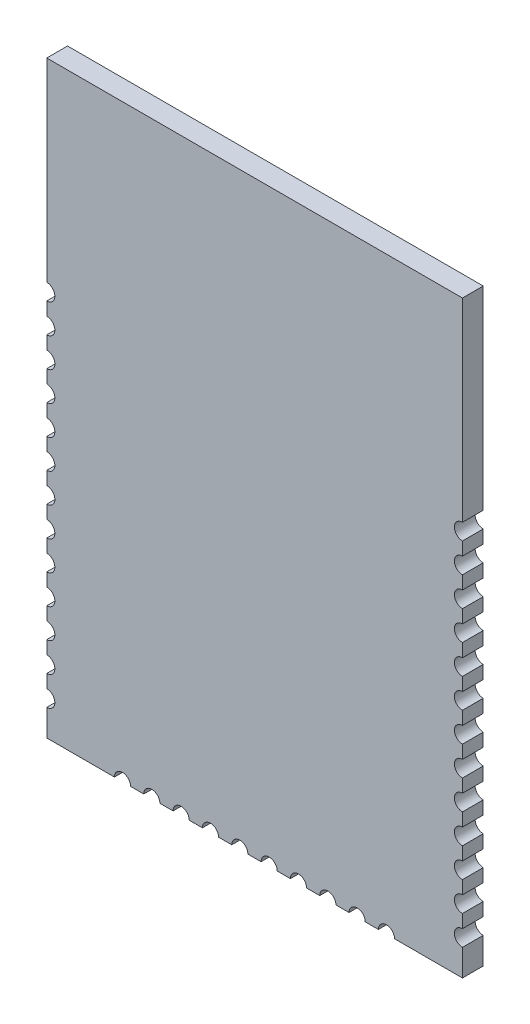
from build123d import *

# Parameters (mm, degrees)
ESBO_O1_W                = 18
ESBO_O1_H                = 25.5
RESSALTO_EXTRUS_O1_DEPTH = 0.45
ESBO_O2_R                = 0.35
CORTE_EXTRUS_O1_DEPTH    = 16.632418239
ESBO_O3_R                = 0.35
CORTE_EXTRUS_O2_DEPTH    = 16.632418239


with BuildPart() as part:
    # Esboço1 → Ressalto-extrusão1 (new, symmetric)
    with BuildSketch(Plane.XY):
        Rectangle(ESBO_O1_W, ESBO_O1_H)
    extrude(amount=RESSALTO_EXTRUS_O1_DEPTH, both=True)

    # Esboço2 → Corte-extrusão1 (cut, through all)
    with BuildSketch(Plane.XY.offset(0.45)):
        with Locations((-5.72, -12.75)):
            Circle(ESBO_O2_R)
        with Locations((-4.45, -12.75)):
            Circle(ESBO_O2_R)
        with Locations((-3.18, -12.75)):
            Circle(ESBO_O2_R)
        with Locations((-1.91, -12.75)):
            Circle(ESBO_O2_R)
        with Locations((-0.64, -12.75)):
            Circle(ESBO_O2_R)
        with Locations((0.63, -12.75)):
            Circle(ESBO_O2_R)
        with Locations((1.9, -12.75)):
            Circle(ESBO_O2_R)
        with Locations((3.17, -12.75)):
            Circle(ESBO_O2_R)
        with Locations((4.44, -12.75)):
            Circle(ESBO_O2_R)
        with Locations((5.71, -12.75)):
            Circle(ESBO_O2_R)
    extrude(amount=-CORTE_EXTRUS_O1_DEPTH, mode=Mode.SUBTRACT)

    # Esboço3 → Corte-extrusão2 (cut, through all)
    with BuildSketch(Plane.XY.offset(0.45)):
        with Locations((-9, -11.25)):
            Circle(ESBO_O3_R)
        with Locations((-9, -9.98)):
            Circle(ESBO_O3_R)
        with Locations((-9, -8.71)):
            Circle(ESBO_O3_R)
        with Locations((-9, -7.44)):
            Circle(ESBO_O3_R)
        with Locations((-9, -6.17)):
            Circle(ESBO_O3_R)
        with Locations((-9, -4.9)):
            Circle(ESBO_O3_R)
        with Locations((-9, -3.63)):
            Circle(ESBO_O3_R)
        with Locations((-9, -2.36)):
            Circle(ESBO_O3_R)
        with Locations((-9, -1.09)):
            Circle(ESBO_O3_R)
        with Locations((-9, 0.18)):
            Circle(ESBO_O3_R)
        with Locations((-9, 1.45)):
            Circle(ESBO_O3_R)
        with Locations((-9, 2.72)):
            Circle(ESBO_O3_R)
        with Locations((-9, 3.99)):
            Circle(ESBO_O3_R)
        with Locations((9, 3.99)):
            Circle(ESBO_O3_R)
        with Locations((9, 2.72)):
            Circle(ESBO_O3_R)
        with Locations((9, 1.45)):
            Circle(ESBO_O3_R)
        with Locations((9, 0.18)):
            Circle(ESBO_O3_R)
        with Locations((9, -1.09)):
            Circle(ESBO_O3_R)
        with Locations((9, -2.36)):
            Circle(ESBO_O3_R)
        with Locations((9, -3.63)):
            Circle(ESBO_O3_R)
        with Locations((9, -4.9)):
            Circle(ESBO_O3_R)
        with Locations((9, -6.17)):
            Circle(ESBO_O3_R)
        with Locations((9, -7.44)):
            Circle(ESBO_O3_R)
        with Locations((9, -8.71)):
            Circle(ESBO_O3_R)
        with Locations((9, -9.98)):
            Circle(ESBO_O3_R)
        with Locations((9, -11.25)):
            Circle(ESBO_O3_R)
    extrude(amount=-CORTE_EXTRUS_O2_DEPTH, mode=Mode.SUBTRACT)


solid = part.part
